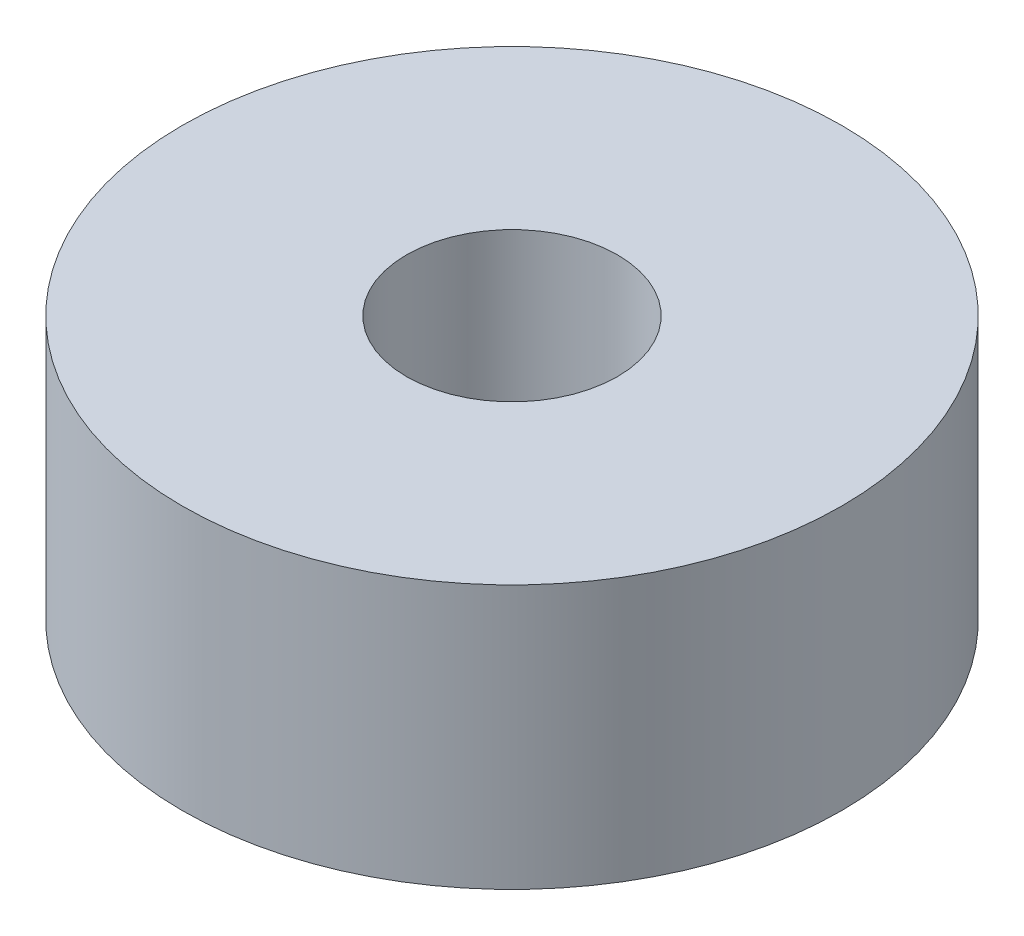
from build123d import *

# Parameters (mm, degrees)
SKETCH1_R           = 12.5
SKETCH1_R_2         = 4
BOSS_EXTRUDE1_DEPTH = 10


with BuildPart() as part:
    # Sketch1 → Boss-Extrude1 (new body)
    with BuildSketch(Plane(origin=(0, 0, 0), x_dir=(1, 0, 0), z_dir=(0, 1, 0))):
        with Locations(Location((0, 0, 0), (0, 0, 270))):
            Circle(SKETCH1_R)
        with Locations(Location((0, 0, 0), (0, 0, 270))):
            Circle(SKETCH1_R_2, mode=Mode.SUBTRACT)
    extrude(amount=BOSS_EXTRUDE1_DEPTH)


solid = part.part
